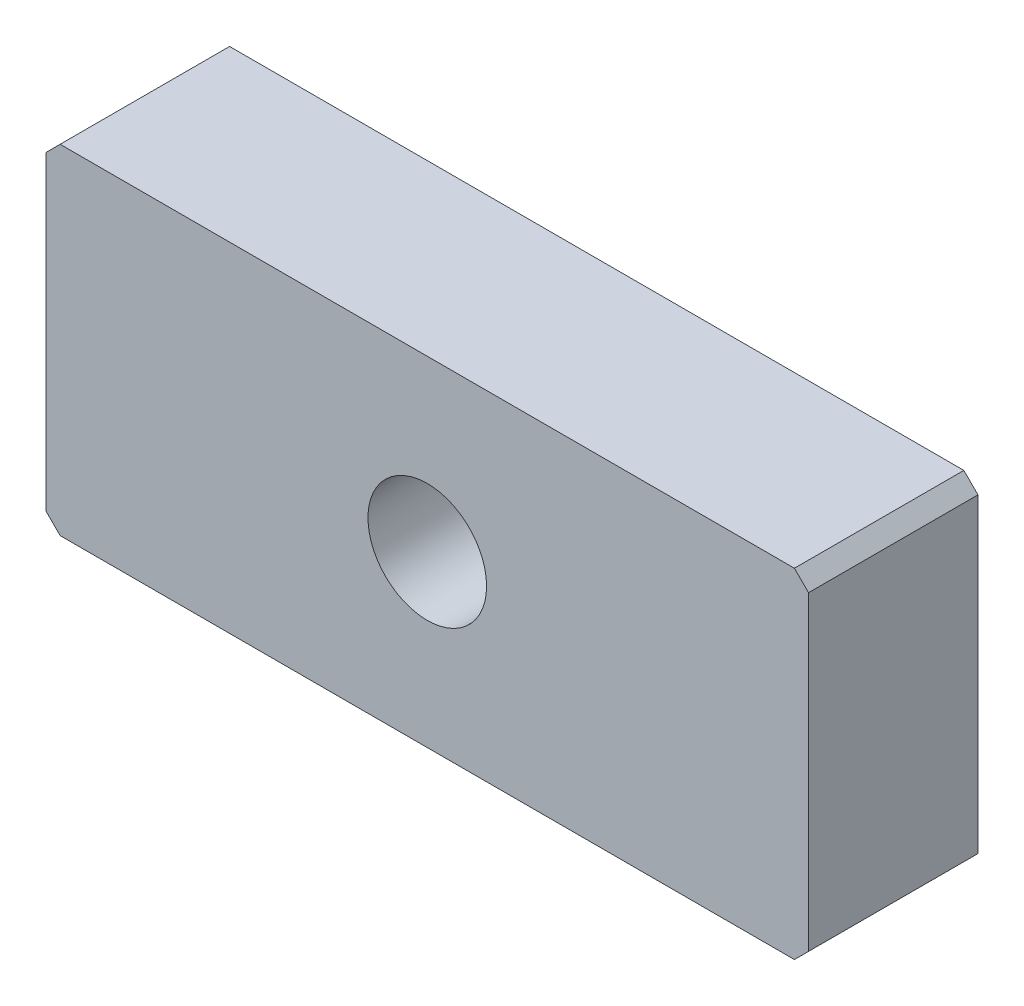
from build123d import *

# Parameters (mm, degrees)
SKETCH1_W           = 27
SKETCH1_H           = 12
SKETCH1_R           = 2.1
BOSS_EXTRUDE1_DEPTH = 6
CHAMFER1_SIZE       = 0.5


with BuildPart() as part:
    # Sketch1 → Boss-Extrude1 (new body)
    with BuildSketch(Plane.XY):
        with Locations((13.5, 6)):
            Rectangle(SKETCH1_W, SKETCH1_H)
        with Locations((13.5, 6)):
            Circle(SKETCH1_R, mode=Mode.SUBTRACT)
    extrude(amount=BOSS_EXTRUDE1_DEPTH)

    # Chamfer1
    chamfer1_edges = [part.edges().sort_by_distance(p)[0] for p in [
        (0, 12, 3),
        (27, 12, 3),
        (27, 0, 3),
        (0, 0, 3),
    ]]
    chamfer(chamfer1_edges, length=CHAMFER1_SIZE)


solid = part.part
